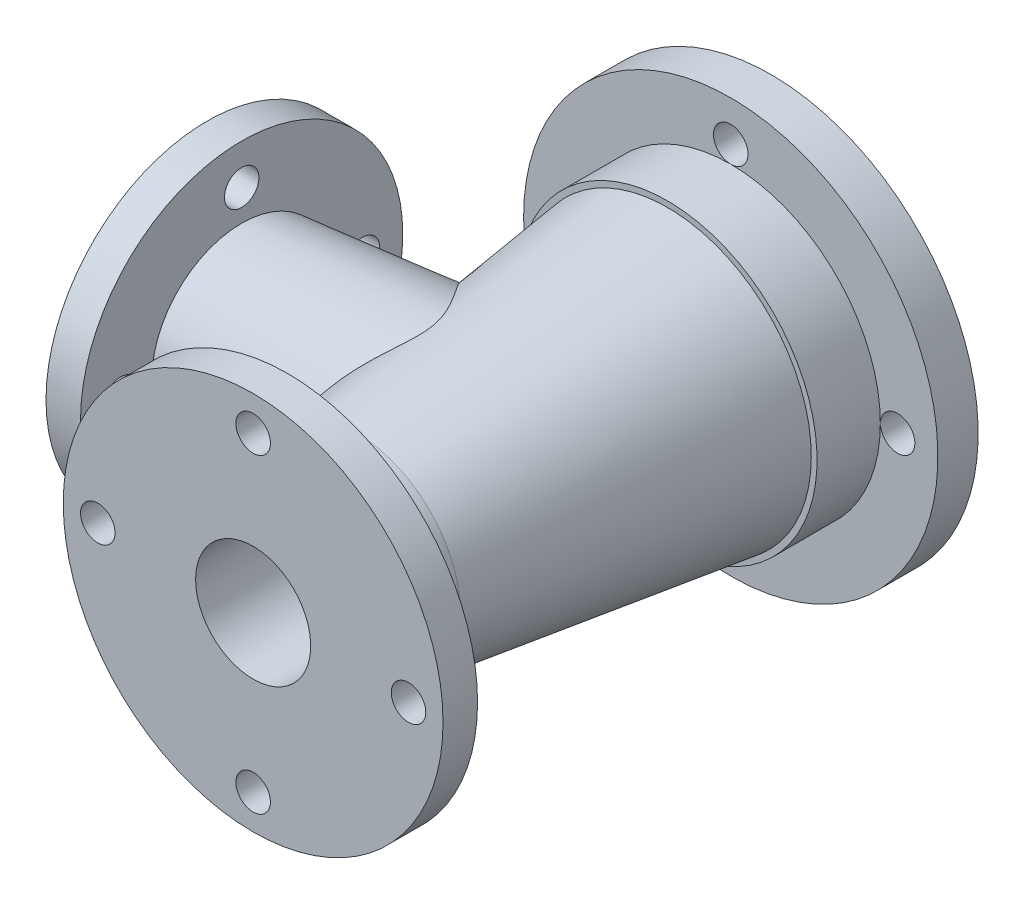
from build123d import *
from build123d.topology import SkipClean

# Parameters (mm, degrees)
SKETCH4_R          = 6
CUT_EXTRUDE1_DEPTH = 12
SKETCH5_R          = 6
CUT_EXTRUDE2_DEPTH = 14
SKETCH14_R         = 6
CUT_EXTRUDE3_DEPTH = 12


with BuildPart() as part:
    # Sketch1 → Revolve1 (revolve)
    with BuildSketch(Plane(origin=(0, 0, 0), x_dir=(1, 0, 0), z_dir=(0, 1, 0)), mode=Mode.PRIVATE) as revolve1_sk:
        Polygon((40, 180), (40, 144), (27, 36), (20, 36), (20, 0), (66, 0), (66, 12), (36, 12), (36, 36), (50, 144), (52, 144), (52, 166), (72, 166), (72, 180), align=None)
    revolve(revolve1_sk.sketch.rotate(Axis((0, 0, -182.979971196), (0, 0, 1)), 180), axis=Axis((0, 0, -182.979971196), (0, 0, 1)))

    # Sketch4 → Cut-Extrude1 (cut)
    with BuildSketch(Plane.XY):
        with Locations((54, 0)):
            Circle(SKETCH4_R)
        with Locations((0, -54)):
            Circle(SKETCH4_R)
        with Locations((-54, 0)):
            Circle(SKETCH4_R)
        with Locations((0, 54)):
            Circle(SKETCH4_R)
    extrude(amount=-CUT_EXTRUDE1_DEPTH, mode=Mode.SUBTRACT)

    # Sketch5 → Cut-Extrude2 (cut)
    with BuildSketch(Plane(origin=(0, 0, -180), x_dir=(-1, 0, 0), z_dir=(0, 0, -1))):
        with Locations((58, 0)):
            Circle(SKETCH5_R)
        with Locations((0, -58)):
            Circle(SKETCH5_R)
        with Locations((-58, 0)):
            Circle(SKETCH5_R)
        with Locations((0, 58)):
            Circle(SKETCH5_R)
    extrude(amount=-CUT_EXTRUDE2_DEPTH, mode=Mode.SUBTRACT)

    # Sketch11 → Revolve2 (revolve)
    with BuildSketch(Plane(origin=(0, 0, 0), x_dir=(1, 0, 0), z_dir=(0, 1, 0)), mode=Mode.PRIVATE) as revolve2_sk:
        Polygon((0, 54.187764991), (-100, 64), (-100, 28), (-88, 28), (-88, 52.774507139), (0, 44.139740331), align=None)
    revolve(revolve2_sk.sketch.rotate(Axis((-156.93032519, 0, -84), (1, 0, 0)), 142.376659073), axis=Axis((-156.93032519, 0, -84), (1, 0, 0)))

    # Sketch12 → Cut-Revolve1 (revolve, cut)
    with BuildSketch(Plane(origin=(0, 0, 0), x_dir=(1, 0, 0), z_dir=(0, 1, 0)), mode=Mode.PRIVATE) as cut_revolve1_sk:
        Polygon((0, 180), (40, 180), (40, 144), (27, 36), (0, 36), align=None)
    revolve(cut_revolve1_sk.sketch.rotate(Axis((0, 0, -182.979971196), (0, 0, 1)), 180), axis=Axis((0, 0, -182.979971196), (0, 0, 1)), mode=Mode.SUBTRACT)

    # Sketch13 → Cut-Revolve2 (revolve, cut)
    with SkipClean():  # the faces are left unmerged after this step: merging them gives an invalid solid
        with BuildSketch(Plane(origin=(0, 0, 0), x_dir=(1, 0, 0), z_dir=(0, 1, 0))):
            Polygon((-100, 64), (0, 54.187764991), (0, 84), (-100, 84), align=None)
        revolve(axis=Axis((-156.93032519, 0, -84), (1, 0, 0)), mode=Mode.SUBTRACT)

    # Sketch14 → Cut-Extrude3 (cut)
    with SkipClean():  # the faces are left unmerged after this step: merging them gives an invalid solid
        with BuildSketch(Plane.ZY.offset(100)):
            with Locations((-42, 0)):
                Circle(SKETCH14_R)
            with Locations(Location((-126, 0, 0), (0, 0, 180))):
                Circle(SKETCH14_R)
            with Locations((-84, 42)):
                Circle(SKETCH14_R)
            with Locations(Location((-84, -42, 0), (0, 0, 180))):
                Circle(SKETCH14_R)
        extrude(amount=-CUT_EXTRUDE3_DEPTH, mode=Mode.SUBTRACT)


solid = part.part
